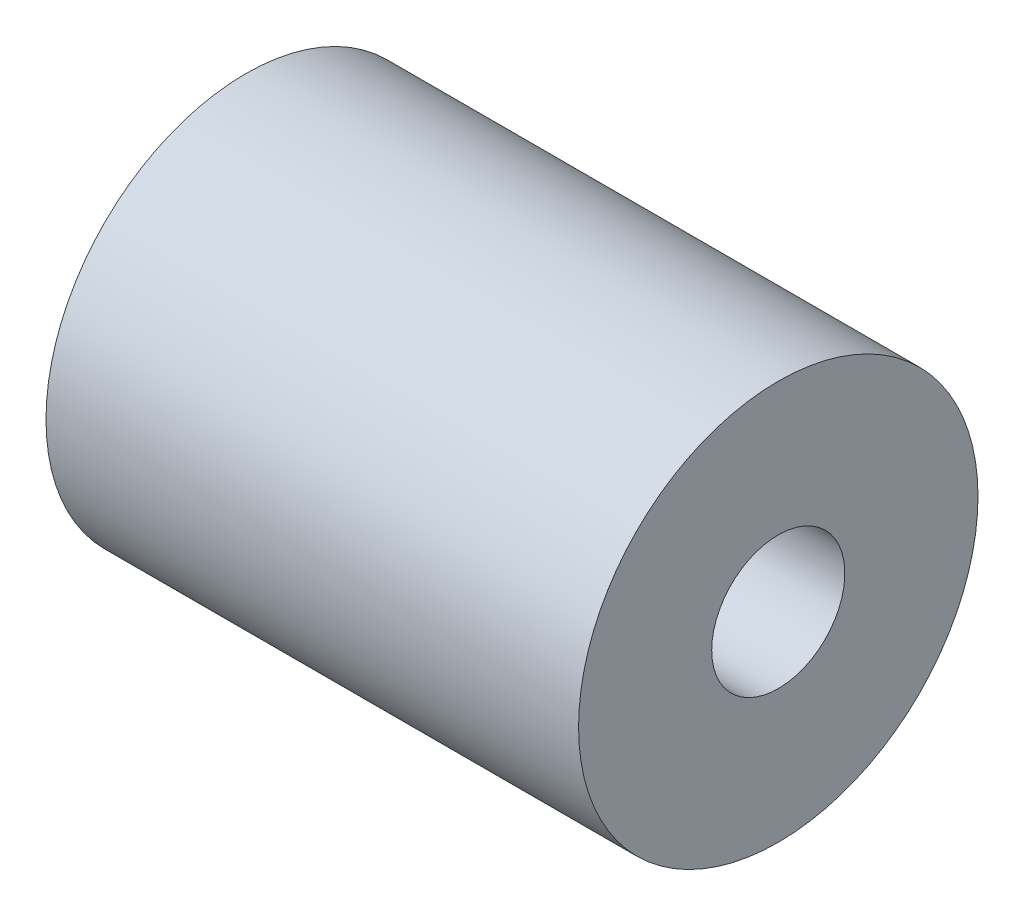
from build123d import *

# Parameters (mm, degrees)
SKETCH1_R           = 9.525
SKETCH1_R_2         = 3.175
BOSS_EXTRUDE1_DEPTH = 25.4


with BuildPart() as part:
    # Sketch1 → Boss-Extrude1 (new body)
    with BuildSketch(Plane(origin=(0, 0, 0), x_dir=(0, 0, -1), z_dir=(1, 0, 0))):
        with Locations(Location((0, 0, 0), (0, 0, 180))):
            Circle(SKETCH1_R)
        with Locations(Location((0, 0, 0), (0, 0, 180))):
            Circle(SKETCH1_R_2, mode=Mode.SUBTRACT)
    extrude(amount=BOSS_EXTRUDE1_DEPTH)


solid = part.part
